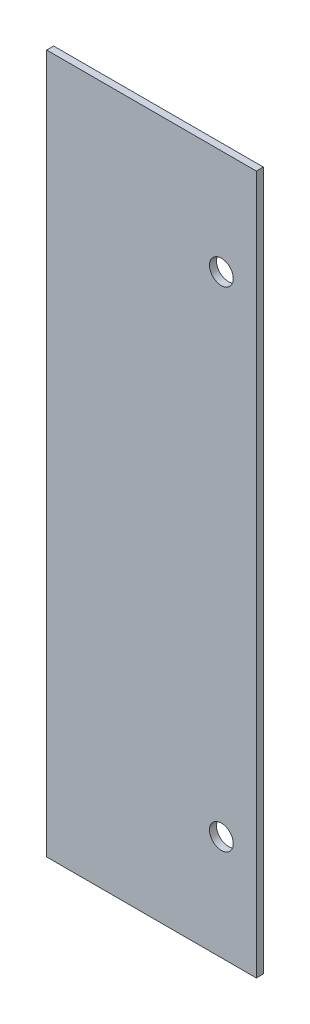
from build123d import *

# Parameters (mm, degrees)
SKETCH1_W               = 30
SKETCH1_H               = 100
BOSS_EXTRUDE1_DEPTH     = 1
CUT_EXTRUDE1_DEPTH      = 53.211109929
CUT_EXTRUDE1_DEPTH_BACK = 53.211109929
SKETCH2_R               = 1.7


with BuildPart() as part:
    # Sketch1 → Boss-Extrude1 (new body)
    with BuildSketch(Plane.XY):
        Rectangle(SKETCH1_W, SKETCH1_H)
    extrude(amount=-BOSS_EXTRUDE1_DEPTH)

    # Sketch2 → Cut-Extrude1 (cut, two sides: drawn at the far end of the back side and taken through both)
    with BuildSketch(Plane.XY.offset(-CUT_EXTRUDE1_DEPTH_BACK)):
        with Locations((10, -35)):
            Circle(SKETCH2_R)
        with Locations((10, 35)):
            Circle(SKETCH2_R)
    extrude(amount=CUT_EXTRUDE1_DEPTH + CUT_EXTRUDE1_DEPTH_BACK, mode=Mode.SUBTRACT)


solid = part.part
